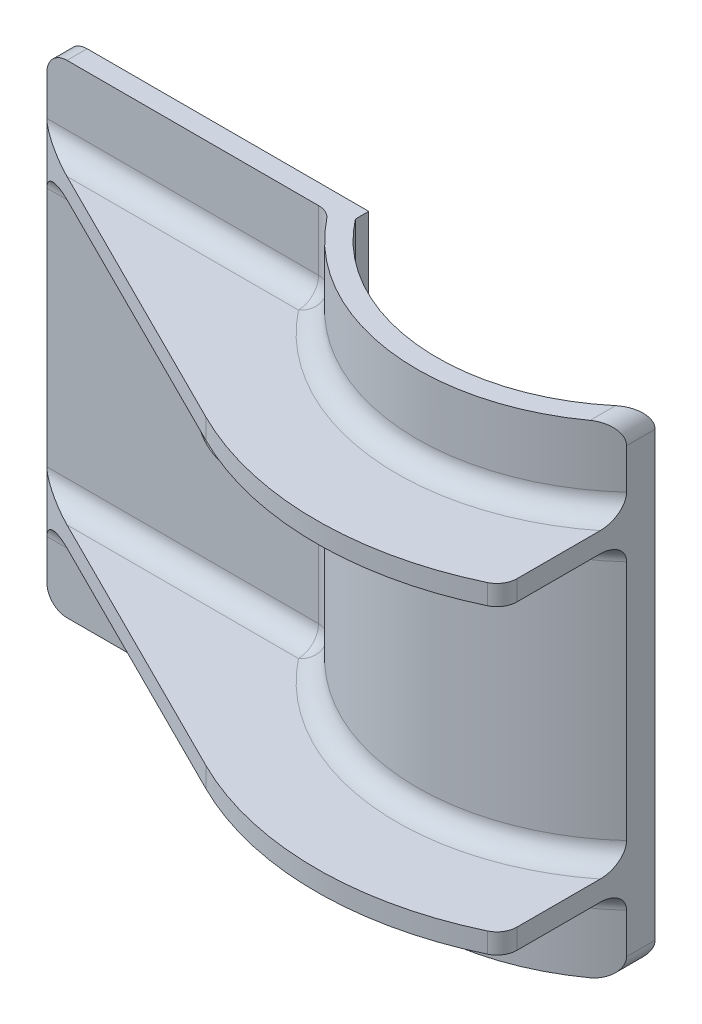
from build123d import *

# Parameters (mm, degrees)
BOSS_EXTRU_1_DEPTH      = 12
BOSS_EXTRU_2_START      = -4
BOSS_EXTRU_2_DEPTH      = 1
CONG_1_R                = 1
ESQUISSE3_R             = 1.5
ENL_V_MAT_EXTRU_1_DEPTH = 28.66152567


with BuildPart() as part:
    # Esquisse1 → Boss.-Extru.1 (new, symmetric)
    with BuildSketch(Plane(origin=(0, 0, 0), x_dir=(1, 0, 0), z_dir=(0, 1, 0))):
        with BuildLine():
            Line((7.5, -6.76461381), (7.5, -8.182909018))
            ThreePointArc((7.5, -8.182909018), (-1.126445761, -11.042695321), (-8.997777503, -6.5))
            Line((-8.997777503, -6.5), (-23, -6.5))
            Line((-23, -6.5), (-23, -5.5))
            Line((-23, -5.5), (-8, -5.5))
            Line((-8, -5.5), (-8, -6.165225057))
            ThreePointArc((-8, -6.165225057), (-0.390277747, -10.092456751), (7.5, -6.76461381))
        make_face()
    extrude(amount=BOSS_EXTRU_1_DEPTH, both=True)

    # Esquisse2 → Boss.-Extru.2 (add)
    with BuildSketch(Plane(origin=(0, 12, 0), x_dir=(1, 0, 0), z_dir=(0, 1, 0)).offset(BOSS_EXTRU_2_START)):
        with BuildLine():
            Line((7.5, -8.182909018), (7.5, -14.246403055))
            ThreePointArc((7.5, -14.246403055), (0.168377113, -16.099119515), (-7.200392055, -14.400151188))
            Line((-7.200392055, -14.400151188), (-23, -6.5))
            Line((-23, -6.5), (-8.997777503, -6.5))
            ThreePointArc((-8.997777503, -6.5), (-1.126445761, -11.042695321), (7.5, -8.182909018))
        make_face()
    boss_extru_2 = extrude(amount=-BOSS_EXTRU_2_DEPTH)

    # Symétrie1: Boss.-Extru.2 across plane
    add(boss_extru_2.mirror(Plane.ZX))

    # Congé1
    cong_1_edges = [part.edges().sort_by_distance(p)[0] for p in [
        (-8.997777503, 10, 6.5),
        (7.5, 12, 7.473761414),
        (-8.997777503, 0, 6.5),
        (-1.126445761, 7, 11.042695321),
        (7.5, 7.5, 14.246403055),
        (-15.998888752, 7, 6.5),
        (-1.126445761, 8, 11.042695321),
        (-15.998888752, 8, 6.5),
        (-8.997777503, -10, 6.5),
        (-23, 12, 6),
        (-1.126445761, -8, 11.042695321),
        (-15.998888752, -8, 6.5),
        (7.5, -7.5, 14.246403055),
        (-1.126445761, -7, 11.042695321),
        (-15.998888752, -7, 6.5),
        (7.5, -12, 7.473761414),
        (-23, -12, 6),
    ]]
    fillet(cong_1_edges, radius=CONG_1_R)

    # Esquisse3 → Enlèv. mat.-Extru.1 (cut, through all)
    with BuildSketch(Plane.XY.offset(6.5)):
        with Locations((-14, 0)):
            Circle(ESQUISSE3_R)
    extrude(amount=-ENL_V_MAT_EXTRU_1_DEPTH, mode=Mode.SUBTRACT)


solid = part.part
